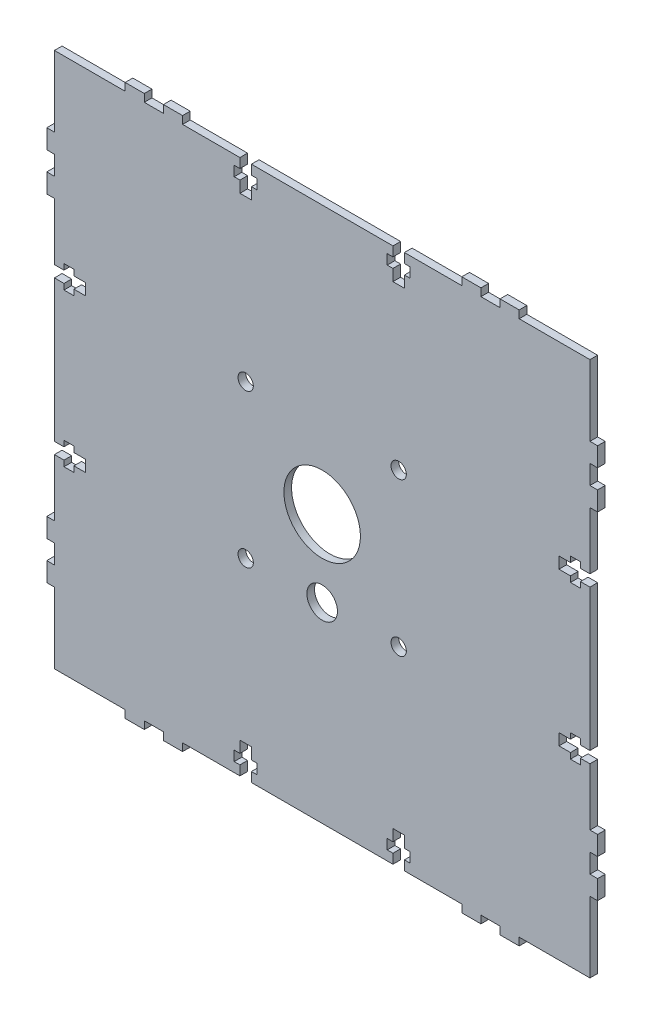
from build123d import *

# Parameters (mm, degrees)
SKETCH_1_R      = 10
SKETCH_1_R_2    = 4
SKETCH_1_R_3    = 2
EXTRUDE_1_DEPTH = 2


with BuildPart() as part:
    # 草图1 → 凸台-拉伸1 (new body)
    with BuildSketch(Plane.XY):
        Polygon((317.453360513, 257.462931603), (317.453360513, 258.962931603), (314.853360513, 258.962931603), (314.853360513, 257.462931603), (311.853360513, 257.462931603), (311.853360513, 254.462931603), (314.853360513, 254.462931603), (314.853360513, 252.962931603), (317.453360513, 252.962931603), (317.453360513, 254.462931603), (319.953360513, 254.462931603), (319.953360513, 239.462931603), (321.953360513, 239.462931603), (321.953360513, 234.462931603), (319.953360513, 234.462931603), (319.953360513, 229.462931603), (321.953360513, 229.462931603), (321.953360513, 224.462931603), (319.953360513, 224.462931603), (319.953360513, 205.962931603), (301.453360513, 205.962931603), (301.453360513, 203.962931603), (296.453360513, 203.962931603), (296.453360513, 205.962931603), (291.453360513, 205.962931603), (291.453360513, 203.962931603), (286.453360513, 203.962931603), (286.453360513, 205.962931603), (271.453360513, 205.962931603), (271.453360513, 208.462931603), (272.953360513, 208.462931603), (272.953360513, 211.062931603), (271.453360513, 211.062931603), (271.453360513, 214.062931603), (268.453360513, 214.062931603), (268.453360513, 211.062931603), (266.953360513, 211.062931603), (266.953360513, 208.462931603), (268.453360513, 208.462931603), (268.453360513, 205.962931603), (231.453360513, 205.962931603), (231.453360513, 208.462931603), (232.953360513, 208.462931603), (232.953360513, 211.062931603), (231.453360513, 211.062931603), (231.453360513, 214.062931603), (228.453360513, 214.062931603), (228.453360513, 211.062931603), (226.953360513, 211.062931603), (226.953360513, 208.462931603), (228.453360513, 208.462931603), (228.453360513, 205.962931603), (213.453360513, 205.962931603), (213.453360513, 203.962931603), (208.453360513, 203.962931603), (208.453360513, 205.962931603), (203.453360513, 205.962931603), (203.453360513, 203.962931603), (198.453360513, 203.962931603), (198.453360513, 205.962931603), (179.953360513, 205.962931603), (179.953360513, 224.462931603), (177.953360513, 224.462931603), (177.953360513, 229.462931603), (179.953360513, 229.462931603), (179.953360513, 234.462931603), (177.953360513, 234.462931603), (177.953360513, 239.462931603), (179.953360513, 239.462931603), (179.953360513, 254.462931603), (182.453360513, 254.462931603), (182.453360513, 252.962931603), (185.053360513, 252.962931603), (185.053360513, 254.462931603), (188.053360513, 254.462931603), (188.053360513, 257.462931603), (185.053360513, 257.462931603), (185.053360513, 258.962931603), (182.453360513, 258.962931603), (182.453360513, 257.462931603), (179.953360513, 257.462931603), (179.953360513, 294.462931603), (182.453360513, 294.462931603), (182.453360513, 292.962931603), (185.053360513, 292.962931603), (185.053360513, 294.462931603), (188.053360513, 294.462931603), (188.053360513, 297.462931603), (185.053360513, 297.462931603), (185.053360513, 298.962931603), (182.453360513, 298.962931603), (182.453360513, 297.462931603), (179.953360513, 297.462931603), (179.953360513, 312.462931603), (177.953360513, 312.462931603), (177.953360513, 317.462931603), (179.953360513, 317.462931603), (179.953360513, 322.462931603), (177.953360513, 322.462931603), (177.953360513, 327.462931603), (179.953360513, 327.462931603), (179.953360513, 345.962931603), (198.453360513, 345.962931603), (198.453360513, 347.962931603), (203.453360513, 347.962931603), (203.453360513, 345.962931603), (208.453360513, 345.962931603), (208.453360513, 347.962931603), (213.453360513, 347.962931603), (213.453360513, 345.962931603), (228.453360513, 345.962931603), (228.453360513, 343.462931603), (226.953360513, 343.462931603), (226.953360513, 340.862931603), (228.453360513, 340.862931603), (228.453360513, 337.862931603), (231.453360513, 337.862931603), (231.453360513, 340.862931603), (232.953360513, 340.862931603), (232.953360513, 343.462931603), (231.453360513, 343.462931603), (231.453360513, 345.962931603), (268.453360513, 345.962931603), (268.453360513, 343.462931603), (266.953360513, 343.462931603), (266.953360513, 340.862931603), (268.453360513, 340.862931603), (268.453360513, 337.862931603), (271.453360513, 337.862931603), (271.453360513, 340.862931603), (272.953360513, 340.862931603), (272.953360513, 343.462931603), (271.453360513, 343.462931603), (271.453360513, 345.962931603), (286.453360513, 345.962931603), (286.453360513, 347.962931603), (291.453360513, 347.962931603), (291.453360513, 345.962931603), (296.453360513, 345.962931603), (296.453360513, 347.962931603), (301.453360513, 347.962931603), (301.453360513, 345.962931603), (319.953360513, 345.962931603), (319.953360513, 327.462931603), (321.953360513, 327.462931603), (321.953360513, 322.462931603), (319.953360513, 322.462931603), (319.953360513, 317.462931603), (321.953360513, 317.462931603), (321.953360513, 312.462931603), (319.953360513, 312.462931603), (319.953360513, 297.462931603), (317.453360513, 297.462931603), (317.453360513, 298.962931603), (314.853360513, 298.962931603), (314.853360513, 297.462931603), (311.853360513, 297.462931603), (311.853360513, 294.462931603), (314.853360513, 294.462931603), (314.853360513, 292.962931603), (317.453360513, 292.962931603), (317.453360513, 294.462931603), (319.953360513, 294.462931603), (319.953360513, 257.462931603), align=None)
        with Locations((249.953360513, 275.962931603)):
            Circle(SKETCH_1_R, mode=Mode.SUBTRACT)
        with Locations((249.953360513, 255.962931603)):
            Circle(SKETCH_1_R_2, mode=Mode.SUBTRACT)
        with Locations((229.953360513, 255.962931603)):
            Circle(SKETCH_1_R_3, mode=Mode.SUBTRACT)
        with Locations((229.953360513, 295.962931603)):
            Circle(SKETCH_1_R_3, mode=Mode.SUBTRACT)
        with Locations((269.953360513, 295.962931603)):
            Circle(SKETCH_1_R_3, mode=Mode.SUBTRACT)
        with Locations((269.953360513, 255.962931603)):
            Circle(SKETCH_1_R_3, mode=Mode.SUBTRACT)
    extrude(amount=EXTRUDE_1_DEPTH)


solid = part.part
